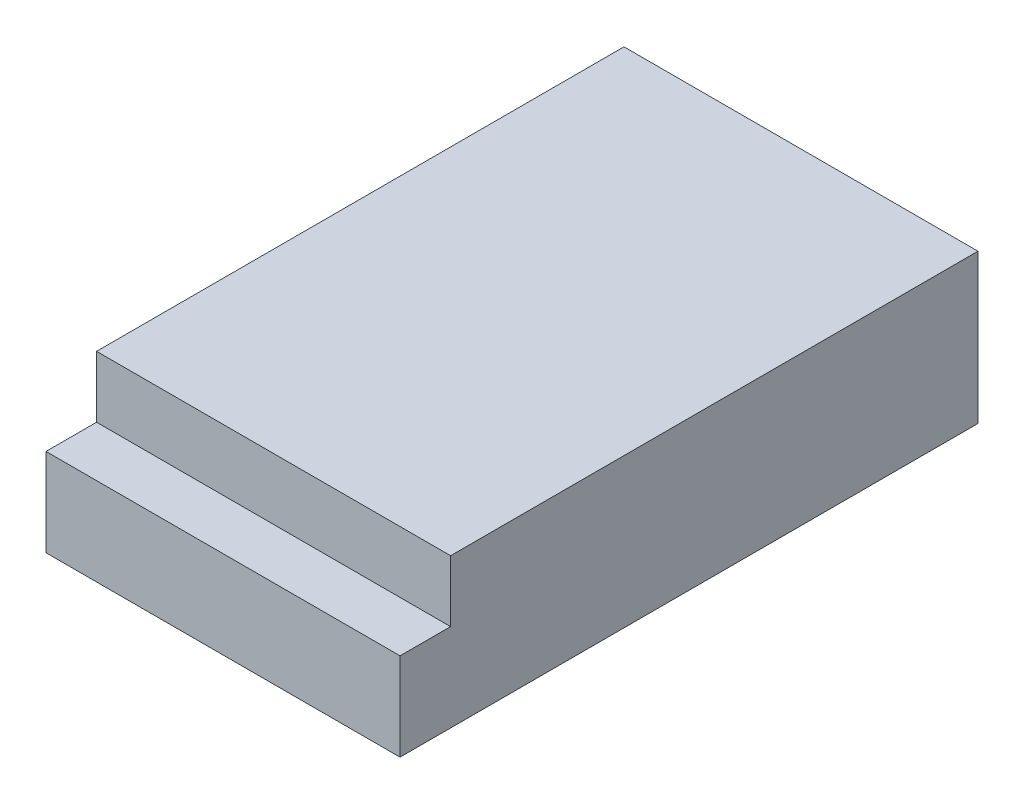
from build123d import *

# Parameters (mm, degrees)
ESBO_O1_W                = 98
ESBO_O1_H                = 160
RESSALTO_EXTRUS_O1_DEPTH = 41.3
ESBO_O2_W                = 14
ESBO_O2_H                = 17
CORTE_EXTRUS_O1_DEPTH    = 134.077759224


with BuildPart() as part:
    # Esboço1 → Ressalto-extrusão1 (new body)
    with BuildSketch(Plane(origin=(0, 0, 0), x_dir=(1, 0, 0), z_dir=(0, 1, 0))):
        Rectangle(ESBO_O1_W, ESBO_O1_H)
    extrude(amount=RESSALTO_EXTRUS_O1_DEPTH)

    # Esboço2 → Corte-extrusão1 (cut, through all)
    with BuildSketch(Plane(origin=(49, 0, 0), x_dir=(0, 0, -1), z_dir=(1, 0, 0))):
        with Locations((-73, 32.8)):
            Rectangle(ESBO_O2_W, ESBO_O2_H)
    extrude(amount=-CORTE_EXTRUS_O1_DEPTH, mode=Mode.SUBTRACT)


solid = part.part
